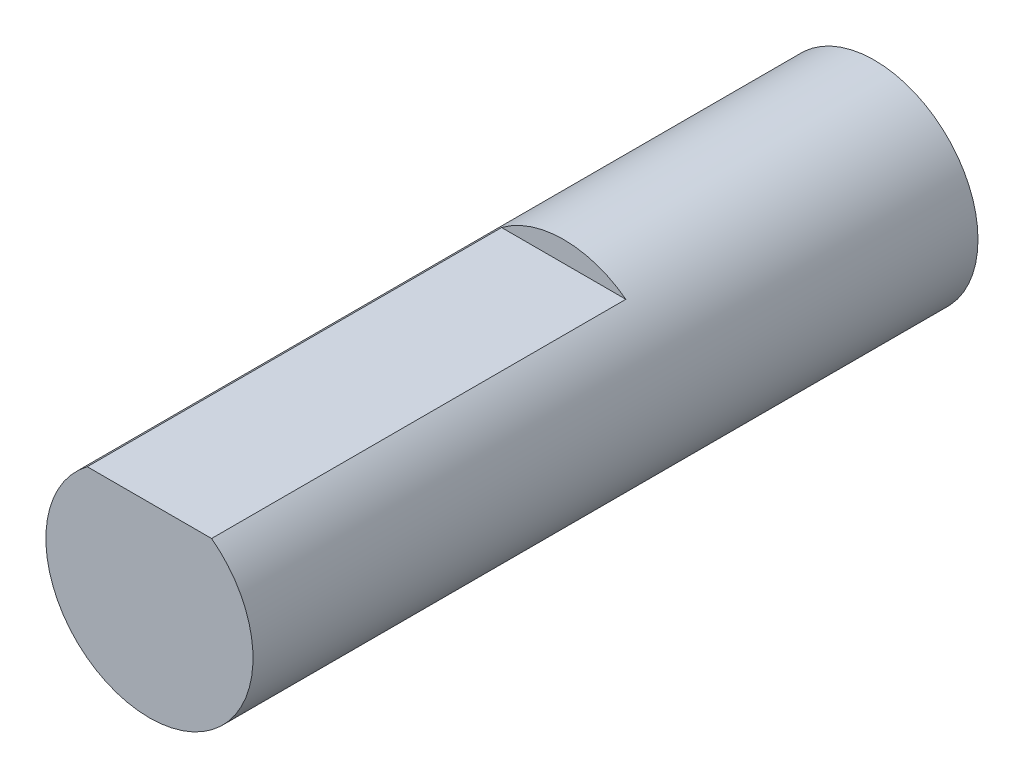
from build123d import *

# Parameters (mm, degrees)
SKETCH1_R           = 2
BOSS_EXTRUDE1_DEPTH = 14
CUT_EXTRUDE1_START  = -8
CUT_EXTRUDE1_DEPTH  = 8


with BuildPart() as part:
    # Sketch1 → Boss-Extrude1 (new body)
    with BuildSketch(Plane.XY):
        Circle(SKETCH1_R)
    extrude(amount=BOSS_EXTRUDE1_DEPTH)

    # Sketch2 → Cut-Extrude1 (cut)
    with BuildSketch(Plane.XY.offset(14).offset(CUT_EXTRUDE1_START)):
        with BuildLine():
            Line((-1.2, 1.6), (1.2, 1.6))
            ThreePointArc((1.2, 1.6), (0, 2), (-1.2, 1.6))
        make_face()
    extrude(amount=CUT_EXTRUDE1_DEPTH, mode=Mode.SUBTRACT)


solid = part.part
